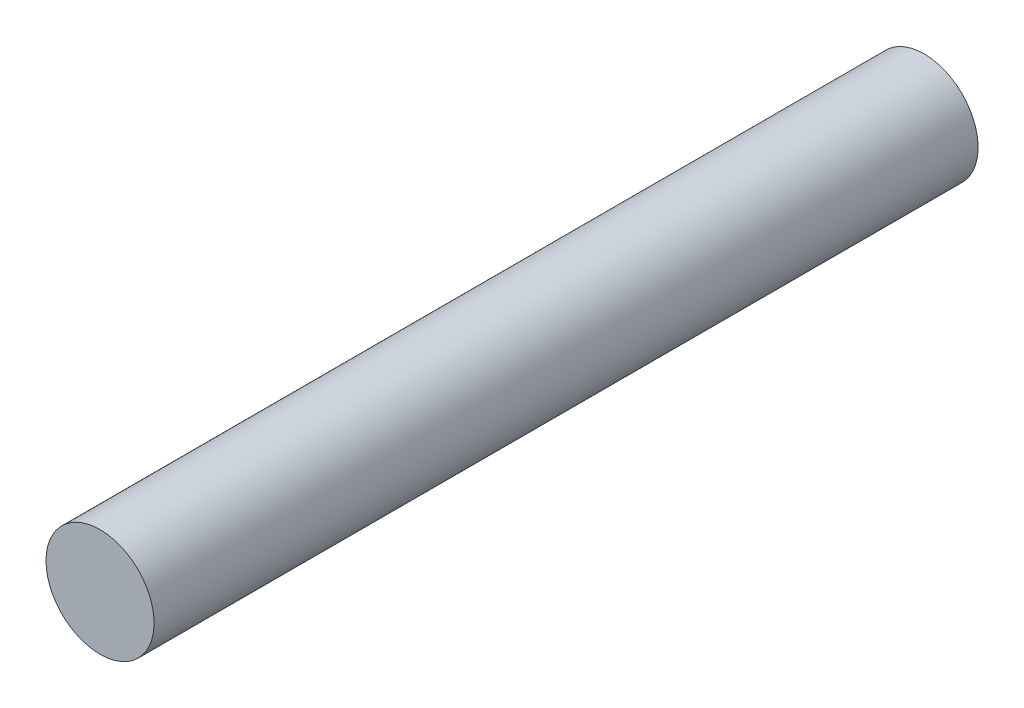
from build123d import *

# Parameters (mm, degrees)
SKETCH1_R           = 4
BOSS_EXTRUDE1_DEPTH = 61


with BuildPart() as part:
    # Sketch1 → Boss-Extrude1 (new body)
    with BuildSketch(Plane.XY):
        with Locations(Location((0, 0, 0), (0, 0, 180))):
            Circle(SKETCH1_R)
    extrude(amount=BOSS_EXTRUDE1_DEPTH)


solid = part.part
